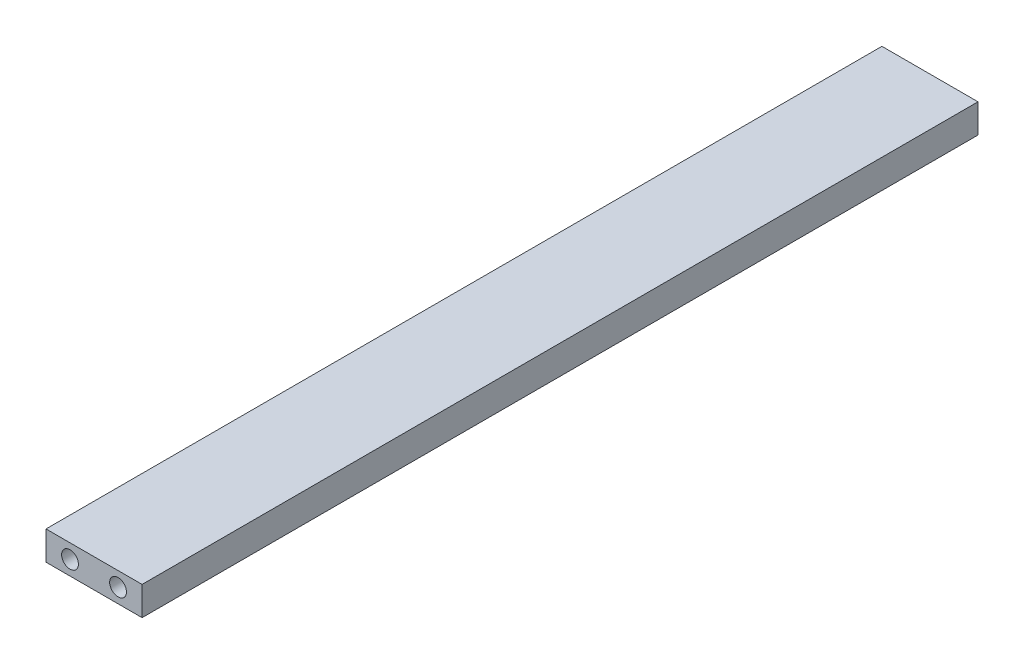
from build123d import *

# Parameters (mm, degrees)
SKETCH1_W               = 20
SKETCH1_H               = 174
MIDLINE_SUPPORT_DEPTH   = 6
SKETCH7_R               = 1.75
FRONT_SCREW_HOLES_DEPTH = 10


with BuildPart() as part:
    # Sketch1 → Midline Support (new body)
    with BuildSketch(Plane(origin=(0, 0, 0), x_dir=(1, 0, 0), z_dir=(0, 1, 0))):
        Rectangle(SKETCH1_W, SKETCH1_H)
    extrude(amount=MIDLINE_SUPPORT_DEPTH)

    # Sketch7 → Front Screw Holes (cut)
    with BuildSketch(Plane.XY.offset(87)):
        with Locations((-5, 3)):
            Circle(SKETCH7_R)
        with Locations((5, 3)):
            Circle(SKETCH7_R)
    front_screw_holes = extrude(amount=-FRONT_SCREW_HOLES_DEPTH, mode=Mode.SUBTRACT)

    # Rear Screw Holes: Front Screw Holes across plane
    add(front_screw_holes.mirror(Plane.XY), mode=Mode.SUBTRACT)


solid = part.part
